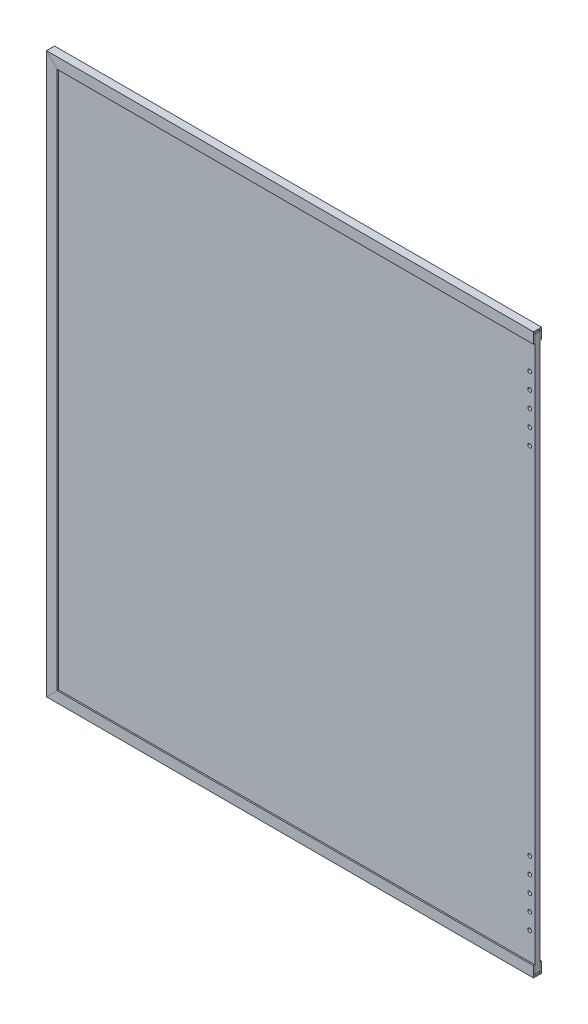
from build123d import *

# Parameters (mm, degrees)
SKETCH2_W                             = 574.675
SKETCH2_H                             = 660.4
FRAME_OUTER_DIMENSIONS_DEPTH          = 4.7625
SKETCH3_W                             = 561.975
SKETCH3_H                             = 635
FRAME_INNER_DIMENSIONS_DEPTH          = 869.053361335
FRAME_PROFILE_DEPTH                   = 3.175
FRAME_PROFILE_DEPTH_BACK              = 3.175
SKETCH4_W                             = 573.0875
SKETCH4_H                             = 657.225
FRAME_SECTION_SPLIT_SURFACE_1_1_BACK  = 876.483
FRAME_SECTION_SPLIT_SURFACE_1_1_DEPTH = 1752.966
FRAME_SECTION_SPLIT_SURFACE_1_2_BACK  = 876.483
FRAME_SECTION_SPLIT_SURFACE_1_2_DEPTH = 1752.966
FRAME_SECTION_SPLIT_SURFACE_2_3_BACK  = 876.483
FRAME_SECTION_SPLIT_SURFACE_2_3_DEPTH = 1752.966
FRAME_SECTION_SPLIT_SURFACE_2_4_BACK  = 876.483
FRAME_SECTION_SPLIT_SURFACE_2_4_DEPTH = 1752.966
SKETCH5_W                             = 571.5
SKETCH5_H                             = 654.05
DOOR_PANEL_DEPTH                      = 2.794
SKETCH9_W                             = 2.2479
SKETCH9_H                             = 7.5565
F_8_CLEARANCE_HOLE1_AT_2_COUNT        = 2
F_8_CLEARANCE_HOLE1_AT_2_PITCH        = 19.05
F_8_CLEARANCE_HOLE1_AT_3_COUNT        = 2
F_8_CLEARANCE_HOLE1_AT_3_PITCH        = 38.1
F_8_CLEARANCE_HOLE1_AT_4_COUNT        = 2
F_8_CLEARANCE_HOLE1_AT_4_PITCH        = 57.15
F_8_CLEARANCE_HOLE1_AT_5_COUNT        = 2
F_8_CLEARANCE_HOLE1_AT_5_PITCH        = 76.2
F_8_CLEARANCE_HOLE1_AT_6_COUNT        = 2
F_8_CLEARANCE_HOLE1_AT_6_PITCH        = 514.35
F_8_CLEARANCE_HOLE1_AT_7_COUNT        = 2
F_8_CLEARANCE_HOLE1_AT_7_PITCH        = 533.4
F_8_CLEARANCE_HOLE1_AT_8_COUNT        = 2
F_8_CLEARANCE_HOLE1_AT_8_PITCH        = 552.45
F_8_CLEARANCE_HOLE1_AT_9_COUNT        = 2
F_8_CLEARANCE_HOLE1_AT_9_PITCH        = 571.5
F_8_CLEARANCE_HOLE1_AT_10_COUNT       = 2
F_8_CLEARANCE_HOLE1_AT_10_PITCH       = 495.3


with BuildPart() as part:
    # Sketch2 → Frame outer dimensions (new, symmetric)
    with BuildSketch(Plane.XY):
        with Locations((290.5125, 317.5)):
            Rectangle(SKETCH2_W, SKETCH2_H)
    extrude(amount=FRAME_OUTER_DIMENSIONS_DEPTH, both=True)

    # Sketch3 → Frame inner dimensions (cut, through all)
    with BuildSketch(Plane.XY.offset(4.7625)):
        with Locations((296.8625, 317.5)):
            Rectangle(SKETCH3_W, SKETCH3_H)
    extrude(amount=-FRAME_INNER_DIMENSIONS_DEPTH, mode=Mode.SUBTRACT)

    # Sketch4 → Frame profile (cut, two sides: drawn at the far end of the back side and taken through both)
    with BuildSketch(Plane.XY.offset(-FRAME_PROFILE_DEPTH_BACK)):
        with Locations((291.30625, 317.5)):
            Rectangle(SKETCH4_W, SKETCH4_H)
    extrude(amount=FRAME_PROFILE_DEPTH + FRAME_PROFILE_DEPTH_BACK, mode=Mode.SUBTRACT)


with BuildPart() as body_2:
    # Frame section split: the piece behind the surface
    add(part.part)
    # Frame section split surface 1: a surface, the sketch's curves swept straight by 1752.966 mm
    with BuildLine(Plane.XY.offset(4.7625).offset(-FRAME_SECTION_SPLIT_SURFACE_1_1_BACK), mode=Mode.PRIVATE) as frame_section_split_surface_1_1_path:
        Line((3.175, 647.7), (15.875, 635))
    frame_section_split_surface_1_1 = Shell.extrude(frame_section_split_surface_1_1_path.wire(), (0 * FRAME_SECTION_SPLIT_SURFACE_1_1_DEPTH, 0 * FRAME_SECTION_SPLIT_SURFACE_1_1_DEPTH, 1 * FRAME_SECTION_SPLIT_SURFACE_1_1_DEPTH))
    split(bisect_by=frame_section_split_surface_1_1, keep=Keep.BOTTOM)


with BuildPart() as part_1:
    add(part.part)

    # Frame section split: split by a surface, the side it looks to stays
    # Frame section split surface 1: a surface, the sketch's curves swept straight by 1752.966 mm
    with BuildLine(Plane.XY.offset(4.7625).offset(-FRAME_SECTION_SPLIT_SURFACE_1_2_BACK), mode=Mode.PRIVATE) as frame_section_split_surface_1_2_path:
        Line((3.175, 647.7), (15.875, 635))
    frame_section_split_surface_1_2 = Shell.extrude(frame_section_split_surface_1_2_path.wire(), (0 * FRAME_SECTION_SPLIT_SURFACE_1_2_DEPTH, 0 * FRAME_SECTION_SPLIT_SURFACE_1_2_DEPTH, 1 * FRAME_SECTION_SPLIT_SURFACE_1_2_DEPTH))
    split(bisect_by=frame_section_split_surface_1_2, keep=Keep.TOP)


with BuildPart() as body_3:
    # Frame section split 2 body 2: the piece behind the surface
    add(body_2.part)
    # Frame section split surface 2: a surface, the sketch's curves swept straight by 1752.966 mm
    with BuildLine(Plane.XY.offset(4.7625).offset(-FRAME_SECTION_SPLIT_SURFACE_2_3_BACK), mode=Mode.PRIVATE) as frame_section_split_surface_2_3_path:
        Line((3.175, -12.7), (15.875, 0))
    frame_section_split_surface_2_3 = Shell.extrude(frame_section_split_surface_2_3_path.wire(), (0 * FRAME_SECTION_SPLIT_SURFACE_2_3_DEPTH, 0 * FRAME_SECTION_SPLIT_SURFACE_2_3_DEPTH, 1 * FRAME_SECTION_SPLIT_SURFACE_2_3_DEPTH))
    split(bisect_by=frame_section_split_surface_2_3, keep=Keep.BOTTOM)


with BuildPart() as body_2_1:
    add(body_2.part)

    # Frame section split 2 body 2: split by a surface, the side it looks to stays
    # Frame section split surface 2: a surface, the sketch's curves swept straight by 1752.966 mm
    with BuildLine(Plane.XY.offset(4.7625).offset(-FRAME_SECTION_SPLIT_SURFACE_2_4_BACK), mode=Mode.PRIVATE) as frame_section_split_surface_2_4_path:
        Line((3.175, -12.7), (15.875, 0))
    frame_section_split_surface_2_4 = Shell.extrude(frame_section_split_surface_2_4_path.wire(), (0 * FRAME_SECTION_SPLIT_SURFACE_2_4_DEPTH, 0 * FRAME_SECTION_SPLIT_SURFACE_2_4_DEPTH, 1 * FRAME_SECTION_SPLIT_SURFACE_2_4_DEPTH))
    split(bisect_by=frame_section_split_surface_2_4, keep=Keep.TOP)


with BuildPart() as body_4:
    # Sketch5 → Door panel (new, symmetric)
    with BuildSketch(Plane.XY):
        with Locations((292.1, 317.5)):
            Rectangle(SKETCH5_W, SKETCH5_H)
    extrude(amount=DOOR_PANEL_DEPTH, both=True)

    # Sketch9 → #8 Clearance Hole1 (revolve, cut)
    with BuildSketch(Plane(origin=(571.5, 31.75, 2.794), x_dir=(0, -1, 0), z_dir=(1, 0, 0))):
        with Locations((1.12395, 3.77825)):
            Rectangle(SKETCH9_W, SKETCH9_H)
    f_8_clearance_hole1 = revolve(axis=Axis((571.5, 31.75, 9.144), (0, 0, -1)), mode=Mode.SUBTRACT)

    # #8 Clearance Hole1 at 2: #8 Clearance Hole1 ×2
    with Locations(*[(0, i * F_8_CLEARANCE_HOLE1_AT_2_PITCH, 0) for i in range(1, F_8_CLEARANCE_HOLE1_AT_2_COUNT)]):
        add(f_8_clearance_hole1, mode=Mode.SUBTRACT)

    # #8 Clearance Hole1 at 3: #8 Clearance Hole1 ×2
    with Locations(*[(0, i * F_8_CLEARANCE_HOLE1_AT_3_PITCH, 0) for i in range(1, F_8_CLEARANCE_HOLE1_AT_3_COUNT)]):
        add(f_8_clearance_hole1, mode=Mode.SUBTRACT)

    # #8 Clearance Hole1 at 4: #8 Clearance Hole1 ×2
    with Locations(*[(0, i * F_8_CLEARANCE_HOLE1_AT_4_PITCH, 0) for i in range(1, F_8_CLEARANCE_HOLE1_AT_4_COUNT)]):
        add(f_8_clearance_hole1, mode=Mode.SUBTRACT)

    # #8 Clearance Hole1 at 5: #8 Clearance Hole1 ×2
    with Locations(*[(0, i * F_8_CLEARANCE_HOLE1_AT_5_PITCH, 0) for i in range(1, F_8_CLEARANCE_HOLE1_AT_5_COUNT)]):
        add(f_8_clearance_hole1, mode=Mode.SUBTRACT)

    # #8 Clearance Hole1 at 6: #8 Clearance Hole1 ×2
    with Locations(*[(0, i * F_8_CLEARANCE_HOLE1_AT_6_PITCH, 0) for i in range(1, F_8_CLEARANCE_HOLE1_AT_6_COUNT)]):
        add(f_8_clearance_hole1, mode=Mode.SUBTRACT)

    # #8 Clearance Hole1 at 7: #8 Clearance Hole1 ×2
    with Locations(*[(0, i * F_8_CLEARANCE_HOLE1_AT_7_PITCH, 0) for i in range(1, F_8_CLEARANCE_HOLE1_AT_7_COUNT)]):
        add(f_8_clearance_hole1, mode=Mode.SUBTRACT)

    # #8 Clearance Hole1 at 8: #8 Clearance Hole1 ×2
    with Locations(*[(0, i * F_8_CLEARANCE_HOLE1_AT_8_PITCH, 0) for i in range(1, F_8_CLEARANCE_HOLE1_AT_8_COUNT)]):
        add(f_8_clearance_hole1, mode=Mode.SUBTRACT)

    # #8 Clearance Hole1 at 9: #8 Clearance Hole1 ×2
    with Locations(*[(0, i * F_8_CLEARANCE_HOLE1_AT_9_PITCH, 0) for i in range(1, F_8_CLEARANCE_HOLE1_AT_9_COUNT)]):
        add(f_8_clearance_hole1, mode=Mode.SUBTRACT)

    # #8 Clearance Hole1 at 10: #8 Clearance Hole1 ×2
    with Locations(*[(0, i * F_8_CLEARANCE_HOLE1_AT_10_PITCH, 0) for i in range(1, F_8_CLEARANCE_HOLE1_AT_10_COUNT)]):
        add(f_8_clearance_hole1, mode=Mode.SUBTRACT)


with BuildPart() as body_5:
    # Mirror1: mirrored copy
    add(body_3.part.mirror(Plane(origin=(0, 0, 0), x_dir=(0, 0, 1), z_dir=(1, 0, 0))))


with BuildPart() as body_6:
    # Mirror1 2: mirrored copy
    add(body_2_1.part.mirror(Plane(origin=(0, 0, 0), x_dir=(0, 0, 1), z_dir=(1, 0, 0))))


with BuildPart() as body_7:
    # Mirror1 3: mirrored copy
    add(part_1.part.mirror(Plane(origin=(0, 0, 0), x_dir=(0, 0, 1), z_dir=(1, 0, 0))))


with BuildPart() as body_8:
    # Mirror1 4: mirrored copy
    add(body_4.part.mirror(Plane(origin=(0, 0, 0), x_dir=(0, 0, 1), z_dir=(1, 0, 0))))


solid = Compound([part_1.part, body_3.part, body_2_1.part, body_4.part])
